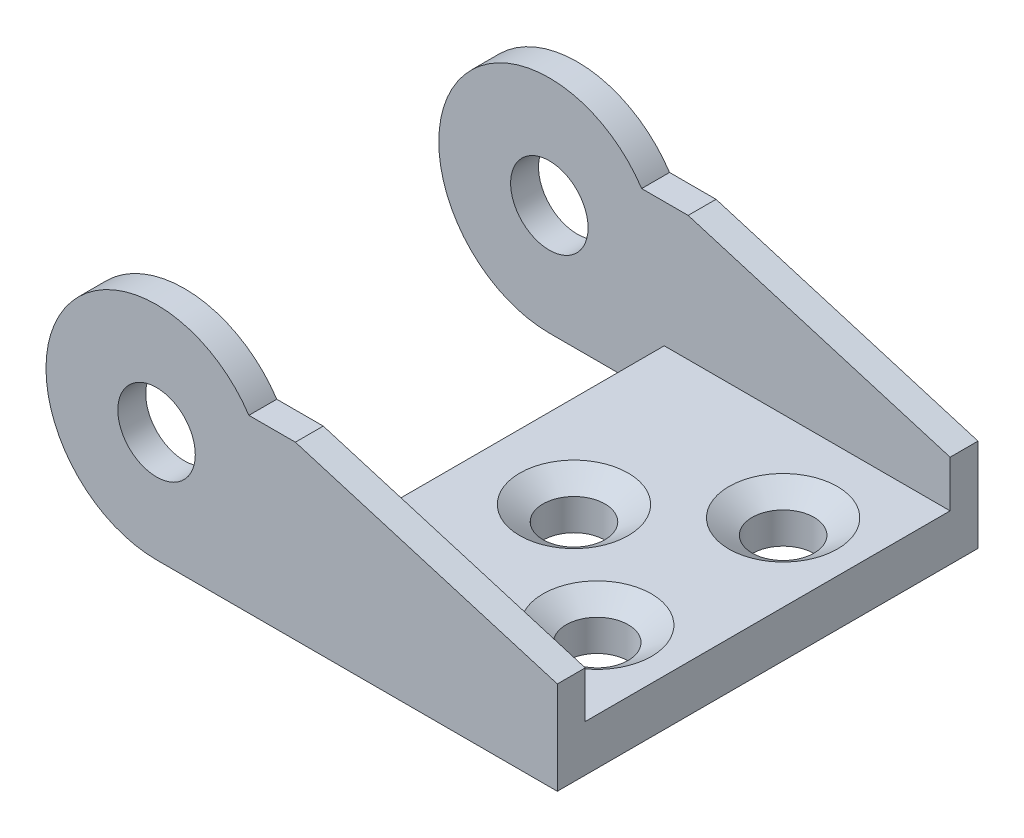
from build123d import *

# Parameters (mm, degrees)
PROFILEBOSS_EXTRUDE1_DEPTH                  = 33
SKETCH2_OUTSIDE_W                           = 44.01
SKETCH2_OUTSIDE_H                           = 25.28
SKETCH2_OUTSIDE_R                           = 2.5
SIDEPROFILECUT_EXTRUDE1_DEPTH               = 46.052806794
BOTTOMCUT_EXTRUDE2_DEPTH                    = 45.194291487
DRAGLINKMOUNTHOLESSKETCH4_R                 = 2
DRAGLINKMOUNTHOLESCUT_EXTRUDE3_DEPTH        = 45.194291487
CHAMFER1_SIZE                               = 1.5
CHAMFER1_SIZE2                              = 0.97411139
SKETCH4_W                                   = 4.5
SKETCH4_H                                   = 17.25
DISABLESWIIVELRESTRICTIONCUT_EXTRUDE4_DEPTH = 45.194291487


with BuildPart() as part:
    # Sketch1 → ProfileBoss-Extrude1 (new body)
    with BuildSketch(Plane(origin=(0, 0, 0), x_dir=(0, 0, -1), z_dir=(1, 0, 0))):
        Polygon((0, 14.27), (0, 0), (27.15, 0), (27.15, 14.27), (25.35, 14.27), (25.35, 3), (1.8, 3), (1.8, 14.27), align=None)
    extrude(amount=PROFILEBOSS_EXTRUDE1_DEPTH)

    # Sketch2 outside → SideProfileCut-Extrude1 (cut, through all)
    # profile 1 of 2: a face of its own
    with BuildSketch(Plane.XY):
        with Locations((16.5, 7.135)):
            Rectangle(SKETCH2_OUTSIDE_W, SKETCH2_OUTSIDE_H)
        with BuildLine():
            Line((13.093405827, 11.06), (16.093405827, 11.06))
            Line((16.093405827, 11.06), (33, 6))
            Line((33, 6), (33, 0))
            Line((33, 0), (7.135, 0))
            ThreePointArc((7.135, 0), (0.853555103, 10.519032358), (13.093405827, 11.06))
        make_face(mode=Mode.SUBTRACT)
    # profile 2 of 2: a face of its own
    with BuildSketch(Plane.XY):
        with Locations((7.135, 7.135)):
            Circle(SKETCH2_OUTSIDE_R)
    extrude(amount=-SIDEPROFILECUT_EXTRUDE1_DEPTH, mode=Mode.SUBTRACT)

    # Sketch3 → BottomCut-Extrude2 (cut, through all)
    with BuildSketch(Plane(origin=(0, 3, 0), x_dir=(1, 0, 0), z_dir=(0, 1, 0))):
        Polygon((1.320363296, 25.35), (14.55, 25.35), (14.55, 22.2), (10.05, 22.2), (10.05, 4.95), (14.55, 4.95), (14.55, 1.8), (1.320363296, 1.8), align=None)
    extrude(amount=-BOTTOMCUT_EXTRUDE2_DEPTH, mode=Mode.SUBTRACT)

    # DragLinkMountHolesSketch4 → DragLinkMountHolesCut-Extrude3 (cut, through all)
    with BuildSketch(Plane(origin=(0, 3, 0), x_dir=(1, 0, 0), z_dir=(0, 1, 0))):
        with Locations(Location((28, 19.575, 0), (0, 0, 270))):
            Circle(DRAGLINKMOUNTHOLESSKETCH4_R)
        with Locations(Location((28, 7.575, 0), (0, 0, 270))):
            Circle(DRAGLINKMOUNTHOLESSKETCH4_R)
        with Locations(Location((20.5, 13.575, 0), (0, 0, 270))):
            Circle(DRAGLINKMOUNTHOLESSKETCH4_R)
    extrude(amount=-DRAGLINKMOUNTHOLESCUT_EXTRUDE3_DEPTH, mode=Mode.SUBTRACT)

    # Chamfer1
    chamfer1_edges = [part.edges().sort_by_distance(p)[0] for p in [
        (28, 3, -21.575),
        (28, 3, -9.575),
        (20.5, 3, -15.575),
    ]]
    chamfer1_side = [part.faces().sort_by_distance(p)[0] for p in [
        (14.878832024, 3, -23.775),
    ]]
    chamfer(chamfer1_edges, length=CHAMFER1_SIZE, length2=CHAMFER1_SIZE2, reference=chamfer1_side[0])

    # Sketch4 → DisableSwiivelRestrictionCut-Extrude4 (cut, through all)
    with BuildSketch(Plane(origin=(0, 3, 0), x_dir=(1, 0, 0), z_dir=(0, 1, 0))):
        with Locations((12.3, 13.575)):
            Rectangle(SKETCH4_W, SKETCH4_H)
    extrude(amount=-DISABLESWIIVELRESTRICTIONCUT_EXTRUDE4_DEPTH, mode=Mode.SUBTRACT)


solid = part.part
